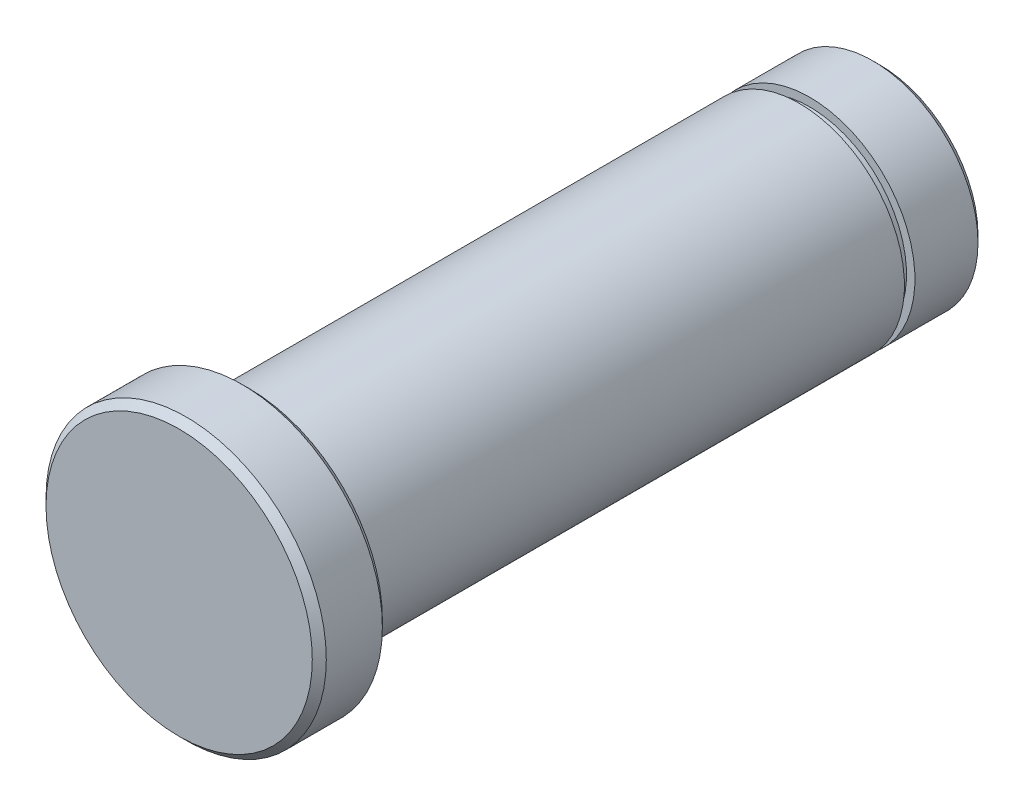
from build123d import *

# Parameters (mm, degrees)
SKETCH_1_R      = 15
EXTRUDE_1_DEPTH = 90
SKETCH_2_R      = 20
EXTRUDE_2_DEPTH = 10
SKETCH_3_W      = 4.032113995
SKETCH_3_H      = 1.5
CHAMFER_1_SIZE  = 1


with BuildPart() as part:
    # 草图1 → 凸台-拉伸1 (new body)
    with BuildSketch(Plane.XY):
        with Locations(Location((0, 0, 0), (0, 0, 180))):
            Circle(SKETCH_1_R)
    extrude(amount=EXTRUDE_1_DEPTH)

    # 草图2 → 凸台-拉伸2 (add)
    with BuildSketch(Plane.XY.offset(90)):
        Circle(SKETCH_2_R)
    extrude(amount=EXTRUDE_2_DEPTH)

    # 草图3 → 切除-旋转1 (revolve, cut)
    with BuildSketch(Plane(origin=(0, 0, 0), x_dir=(1, 0, 0), z_dir=(0, 1, 0))):
        with Locations((-15.816056998, -10.75)):
            Rectangle(SKETCH_3_W, SKETCH_3_H)
    revolve(axis=Axis((0, 0, 0), (0, 0, 1)), mode=Mode.SUBTRACT)

    # 倒角1
    chamfer_1_edges = [part.edges().sort_by_distance(p)[0] for p in [
        (15, 0, 0),
        (-20, 0, 90),
        (-20, 0, 100),
    ]]
    chamfer(chamfer_1_edges, length=CHAMFER_1_SIZE)


solid = part.part
